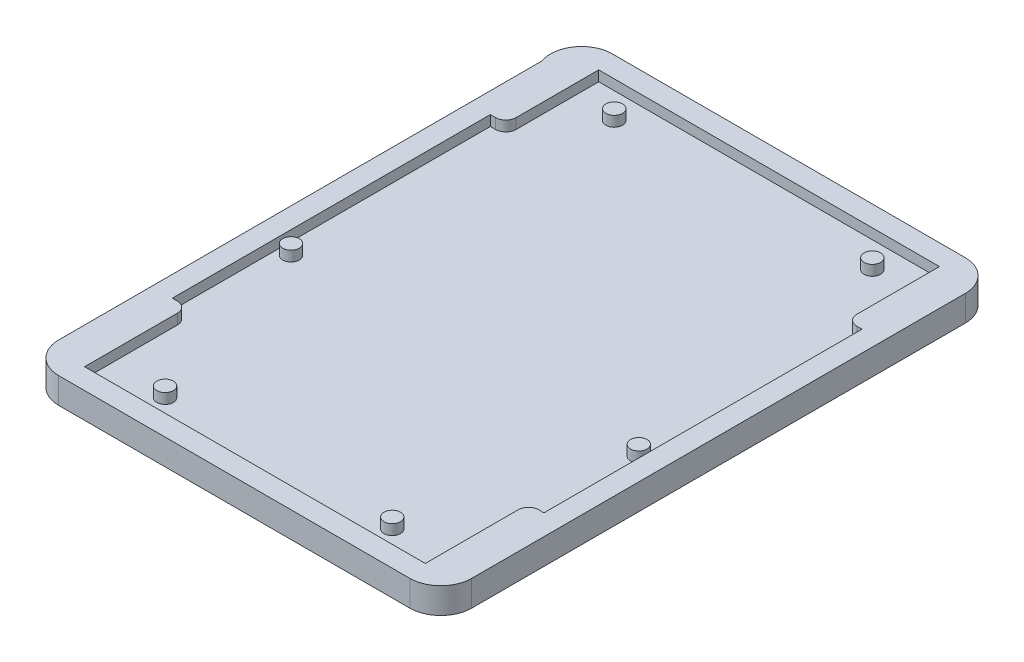
from build123d import *

# Parameters (mm, degrees)
SKETCH_1_W          = 72
SKETCH_1_H          = 99.6
SKETCH_1_R          = 1.6
EXTRUDE_1_DEPTH     = 2
FILLET_1_R          = 3
SKETCH_7_W          = 2.173613934
SKETCH_7_H          = 4.368539476
CUT_EXTRUDE_1_DEPTH = 10
CUT_EXTRUDE_2_DEPTH = 10
FILLET_2_R          = 2
SKETCH_9_W          = 2.173613934
SKETCH_9_H          = 2.184269738
EXTRUDE_5_DEPTH     = 2
FILLET_4_R          = 2
FILLET_5_R          = 2
EXTRUDE_4_DEPTH     = 5


with BuildPart() as part:
    # 草图1 → 凸台-拉伸1 (new body)
    with BuildSketch(Plane(origin=(0, 0, 0), x_dir=(1, 0, 0), z_dir=(0, 1, 0))):
        with Locations((36, -49.8)):
            Rectangle(SKETCH_1_W, SKETCH_1_H)
        with Locations((11, -5)):
            Circle(SKETCH_1_R, mode=Mode.SUBTRACT)
        with Locations((14, -95)):
            Circle(SKETCH_1_R, mode=Mode.SUBTRACT)
        with Locations((58, -95)):
            Circle(SKETCH_1_R, mode=Mode.SUBTRACT)
        with Locations((61, -5)):
            Circle(SKETCH_1_R, mode=Mode.SUBTRACT)
        with Locations((2.31, -58.92)):
            Circle(SKETCH_1_R, mode=Mode.SUBTRACT)
        with Locations((69.69, -58.92)):
            Circle(SKETCH_1_R, mode=Mode.SUBTRACT)
    extrude(amount=EXTRUDE_1_DEPTH)

    # 圆角1
    fillet_1_edges = [part.edges().sort_by_distance(p)[0] for p in [
        (0, 1, 0),
        (72, 1, 0),
        (72, 1, 99.6),
        (0, 1, 99.6),
    ]]
    fillet(fillet_1_edges, radius=FILLET_1_R)

    # 草图7 → 切除-拉伸1 (cut)
    with BuildSketch(Plane(origin=(0, 2, 0), x_dir=(1, 0, 0), z_dir=(0, 1, 0))):
        with Locations((36, -99.6)):
            Rectangle(SKETCH_7_W, SKETCH_7_H)
    extrude(amount=-CUT_EXTRUDE_1_DEPTH, mode=Mode.SUBTRACT)

    # 草图8 → 切除-拉伸2 (cut)
    with BuildSketch(Plane(origin=(0, 2, 0), x_dir=(1, 0, 0), z_dir=(0, 1, 0))):
        with BuildLine():
            Line((3, -99.6), (3, -79.6))
            Line((3, -79.6), (0, -79.6))
            Line((0, -79.6), (0, -96.6))
            ThreePointArc((0, -96.6), (0.878679656, -98.721320344), (3, -99.6))
        make_face()
        with BuildLine():
            Line((0, -3), (0, -18))
            Line((0, -18), (3, -18))
            Line((3, -18), (3, 0))
            ThreePointArc((3, 0), (0.878679656, -0.878679656), (0, -3))
        make_face()
        with BuildLine():
            Line((69, -79.6), (69, -99.6))
            ThreePointArc((69, -99.6), (71.121320344, -98.721320344), (72, -96.6))
            Line((72, -96.6), (72, -79.6))
            Line((72, -79.6), (69, -79.6))
        make_face()
    cut_extrude_2 = extrude(amount=-CUT_EXTRUDE_2_DEPTH, mode=Mode.SUBTRACT)

    # 圆角2
    fillet_2_edges = [part.edges().sort_by_distance(p)[0] for p in [
        (3, 1, 79.6),
        (69, 1, 79.6),
    ]]
    fillet(fillet_2_edges, radius=FILLET_2_R)

    # 镜向2: 切除-拉伸2 across plane
    add(cut_extrude_2.mirror(Plane(origin=(36, 0, 0), x_dir=(0, 0, 1), z_dir=(1, 0, 0))), mode=Mode.SUBTRACT)

    # 草图9 → 凸台-拉伸5 (add)
    with BuildSketch(Plane(origin=(0, 2, 0), x_dir=(1, 0, 0), z_dir=(0, 1, 0))):
        with Locations((36, -98.507865131)):
            Rectangle(SKETCH_9_W, SKETCH_9_H)
    extrude(amount=-EXTRUDE_5_DEPTH)

    # 圆角4
    fillet_4_edges = [part.edges().sort_by_distance(p)[0] for p in [
        (69, 1, 18),
        (3, 1, 18),
    ]]
    fillet(fillet_4_edges, radius=FILLET_4_R)

    # 圆角5
    fillet_5_edges = [part.edges().sort_by_distance(p)[0] for p in [
        (3, 1, 79.6),
        (69, 1, 79.6),
    ]]
    fillet(fillet_5_edges, radius=FILLET_5_R)


with BuildPart() as body_2:
    # 草图6 → 凸台-拉伸4 (new body)
    with BuildSketch(Plane(origin=(0, -3, 0), x_dir=(-1, 0, 0), z_dir=(0, -1, 0))):
        with BuildLine():
            Line((-2, 4), (-70, 4))
            ThreePointArc((-70, 4), (-74.242640687, 2.242640687), (-76, -2))
            Line((-76, -2), (-76, -18))
            Line((-76, -18), (-76, -97.6))
            ThreePointArc((-76, -97.6), (-74.242640687, -101.842640687), (-70, -103.6))
            Line((-70, -103.6), (-2, -103.6))
            ThreePointArc((-2, -103.6), (2.242640687, -101.842640687), (4, -97.6))
            Line((4, -97.6), (4, -4))
            ThreePointArc((4, -4), (3.146700168, 1.610025126), (-2, 4))
        make_face()
    extrude(amount=-EXTRUDE_4_DEPTH)

    # Combine 1: cut part
    add(part.part, mode=Mode.SUBTRACT)


solid = body_2.part
